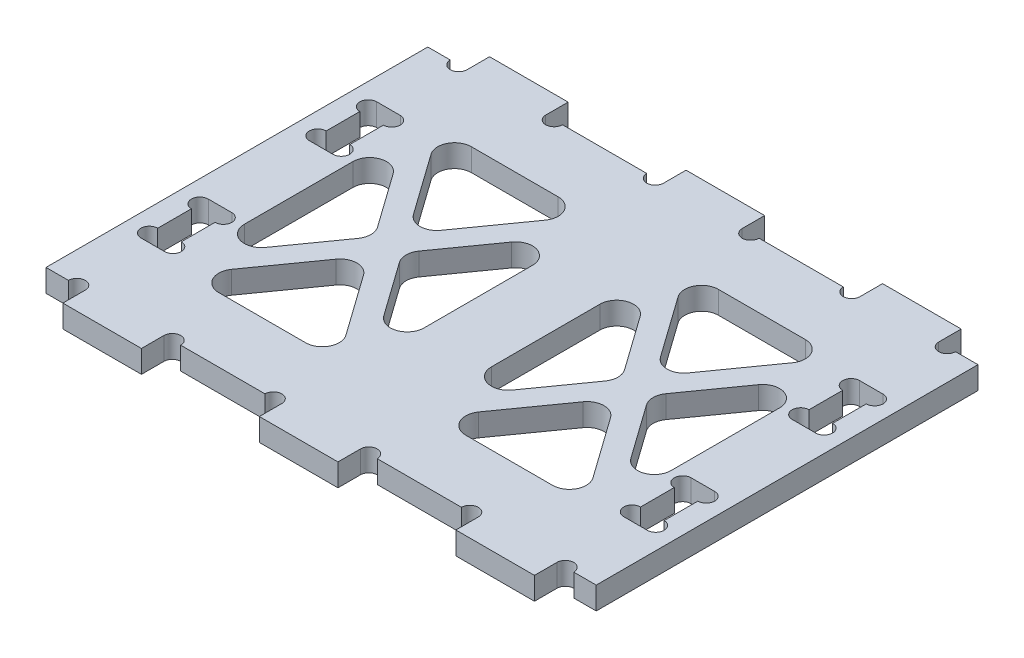
from build123d import *

# Parameters (mm, degrees)
SKETCH_1_W          = 14
SKETCH_1_H          = 4
SKETCH_1_W_2        = 98
SKETCH_1_H_2        = 68
EXTRUDE_1_DEPTH     = 4
SKETCH_2_R          = 1.5
CUT_EXTRUDE_1_DEPTH = 4
SKETCH_3_R          = 1.5
SKETCH_3_W          = 4.2
SKETCH_3_H          = 12
CUT_EXTRUDE_2_DEPTH = 10
CUT_EXTRUDE_3_DEPTH = 5
FILLET_1_R          = 3


with BuildPart() as part:
    # 草图1 → 凸台-拉伸1 (new body)
    with BuildSketch(Plane(origin=(0, 0, 0), x_dir=(1, 0, 0), z_dir=(0, 1, 0))):
        with Locations((-35, -36)):
            Rectangle(SKETCH_1_W, SKETCH_1_H)
        Rectangle(SKETCH_1_W_2, SKETCH_1_H_2)
        with Locations((0, -36)):
            Rectangle(SKETCH_1_W, SKETCH_1_H)
        with Locations((35, -36)):
            Rectangle(SKETCH_1_W, SKETCH_1_H)
        with Locations((-35, 36)):
            Rectangle(SKETCH_1_W, SKETCH_1_H)
        with Locations((35, 36)):
            Rectangle(SKETCH_1_W, SKETCH_1_H)
        with Locations((0, 36)):
            Rectangle(SKETCH_1_W, SKETCH_1_H)
    extrude(amount=EXTRUDE_1_DEPTH)

    # 草图2 → 切除-拉伸1 (cut)
    with BuildSketch(Plane(origin=(0, 4, 0), x_dir=(1, 0, 0), z_dir=(0, 1, 0))):
        with Locations((-43.5, 34)):
            Circle(SKETCH_2_R)
        with Locations((-26.5, 34)):
            Circle(SKETCH_2_R)
        with Locations((-8.5, 34)):
            Circle(SKETCH_2_R)
        with Locations((-43.5, -34)):
            Circle(SKETCH_2_R)
        with Locations((-26.5, -34)):
            Circle(SKETCH_2_R)
        with Locations((-8.5, -34)):
            Circle(SKETCH_2_R)
        with Locations((8.5, 34)):
            Circle(SKETCH_2_R)
        with Locations((26.5, 34)):
            Circle(SKETCH_2_R)
        with Locations((26.5, -34)):
            Circle(SKETCH_2_R)
        with Locations((8.5, -34)):
            Circle(SKETCH_2_R)
        with Locations((43.5, -34)):
            Circle(SKETCH_2_R)
        with Locations((43.5, 34)):
            Circle(SKETCH_2_R)
    extrude(amount=-CUT_EXTRUDE_1_DEPTH, mode=Mode.SUBTRACT)

    # 草图3 → 切除-拉伸2 (cut)
    with BuildSketch(Plane(origin=(0, 4, 0), x_dir=(1, 0, 0), z_dir=(0, 1, 0))):
        with Locations((45.1, 10.5)):
            Circle(SKETCH_3_R)
        with Locations((45.1, 19.5)):
            Circle(SKETCH_3_R)
        with Locations((40.9, 19.5)):
            Circle(SKETCH_3_R)
        with Locations((40.9, 10.5)):
            Circle(SKETCH_3_R)
        with Locations((43, 15)):
            Rectangle(SKETCH_3_W, SKETCH_3_H)
        with BuildLine():
            ThreePointArc((42.4, 10.5), (41.960660172, 11.560660172), (40.9, 12))
            Line((40.9, 12), (40.9, 9))
            ThreePointArc((40.9, 9), (41.960660172, 9.439339828), (42.4, 10.5))
        make_face()
        with BuildLine():
            Line((40.9, 9), (40.9, 12))
            ThreePointArc((40.9, 12), (39.4, 10.5), (40.9, 9))
        make_face()
        with BuildLine():
            ThreePointArc((42.4, 19.5), (41.960660172, 20.560660172), (40.9, 21))
            Line((40.9, 21), (40.9, 18))
            ThreePointArc((40.9, 18), (41.960660172, 18.439339828), (42.4, 19.5))
        make_face()
        with BuildLine():
            Line((40.9, 18), (40.9, 21))
            ThreePointArc((40.9, 21), (39.4, 19.5), (40.9, 18))
        make_face()
        with BuildLine():
            ThreePointArc((46.6, 19.5), (46.160660172, 20.560660172), (45.1, 21))
            Line((45.1, 21), (45.1, 18))
            ThreePointArc((45.1, 18), (46.160660172, 18.439339828), (46.6, 19.5))
        make_face()
        with BuildLine():
            Line((45.1, 18), (45.1, 21))
            ThreePointArc((45.1, 21), (43.6, 19.5), (45.1, 18))
        make_face()
        with BuildLine():
            ThreePointArc((46.6, 10.5), (46.160660172, 11.560660172), (45.1, 12))
            Line((45.1, 12), (45.1, 9))
            ThreePointArc((45.1, 9), (46.160660172, 9.439339828), (46.6, 10.5))
        make_face()
        with BuildLine():
            Line((45.1, 9), (45.1, 12))
            ThreePointArc((45.1, 12), (43.6, 10.5), (45.1, 9))
        make_face()
        with BuildLine():
            ThreePointArc((40.9, -18), (39.4, -19.5), (40.9, -21))
            Line((40.9, -21), (40.9, -18))
        make_face()
        with BuildLine():
            Line((40.9, -18), (40.9, -21))
            ThreePointArc((40.9, -21), (41.960660172, -20.560660172), (42.4, -19.5))
            ThreePointArc((42.4, -19.5), (41.960660172, -18.439339828), (40.9, -18))
        make_face()
        with Locations((40.9, -19.5)):
            Circle(SKETCH_3_R)
        with Locations((45.1, -19.5)):
            Circle(SKETCH_3_R)
        with Locations((45.1, -10.5)):
            Circle(SKETCH_3_R)
        with Locations((40.9, -10.5)):
            Circle(SKETCH_3_R)
        with Locations((43, -15)):
            Rectangle(SKETCH_3_W, SKETCH_3_H)
        with BuildLine():
            ThreePointArc((45.1, -18), (43.6, -19.5), (45.1, -21))
            Line((45.1, -21), (45.1, -18))
        make_face()
        with BuildLine():
            Line((45.1, -18), (45.1, -21))
            ThreePointArc((45.1, -21), (46.160660172, -20.560660172), (46.6, -19.5))
            ThreePointArc((46.6, -19.5), (46.160660172, -18.439339828), (45.1, -18))
        make_face()
        with BuildLine():
            ThreePointArc((40.9, -9), (39.4, -10.5), (40.9, -12))
            Line((40.9, -12), (40.9, -9))
        make_face()
        with BuildLine():
            Line((40.9, -9), (40.9, -12))
            ThreePointArc((40.9, -12), (41.960660172, -11.560660172), (42.4, -10.5))
            ThreePointArc((42.4, -10.5), (41.960660172, -9.439339828), (40.9, -9))
        make_face()
        with BuildLine():
            ThreePointArc((45.1, -9), (43.6, -10.5), (45.1, -12))
            Line((45.1, -12), (45.1, -9))
        make_face()
        with BuildLine():
            Line((45.1, -9), (45.1, -12))
            ThreePointArc((45.1, -12), (46.160660172, -11.560660172), (46.6, -10.5))
            ThreePointArc((46.6, -10.5), (46.160660172, -9.439339828), (45.1, -9))
        make_face()
    cut_extrude_2 = extrude(amount=-CUT_EXTRUDE_2_DEPTH, mode=Mode.SUBTRACT)

    # 镜向1: 切除-拉伸2 across plane
    add(cut_extrude_2.mirror(Plane(origin=(0, 0, 0), x_dir=(0, 0, 1), z_dir=(1, 0, 0))), mode=Mode.SUBTRACT)

    # 草图4 → 切除-拉伸3 (cut)
    with BuildSketch(Plane(origin=(0, 4, 0), x_dir=(1, 0, 0), z_dir=(0, 1, 0))):
        Polygon((-24.454122256, 0), (-38, 19.048890577), (-38, -19.048890577), align=None)
        Polygon((-8.454122256, 22.5), (-35.545877744, 22.5), (-22, 3.451109423), align=None)
        Polygon((-6, 19.048890577), (-19.545877744, 0), (-6, -19.048890577), align=None)
        Polygon((-8.454122256, -22.5), (-22, -3.451109423), (-35.545877744, -22.5), align=None)
        Polygon((19.545877744, 0), (6, 19.048890577), (6, -19.048890577), align=None)
        Polygon((8.454122256, 22.5), (22, 3.451109423), (35.545877744, 22.5), align=None)
        Polygon((38, 19.048890577), (24.454122256, 0), (38, -19.048890577), align=None)
        Polygon((35.545877744, -22.5), (22, -3.451109423), (8.454122256, -22.5), align=None)
    extrude(amount=-CUT_EXTRUDE_3_DEPTH, mode=Mode.SUBTRACT)

    # 圆角1
    fillet_1_edges = [part.edges().sort_by_distance(p)[0] for p in [
        (6, 2, -19.048890577),
        (19.545877744, 2, 0),
        (6, 2, 19.048890577),
        (-22, 2, 3.451109423),
        (-8.454122256, 2, 22.5),
        (-35.545877744, 2, 22.5),
        (-8.454122256, 2, -22.5),
        (-22, 2, -3.451109423),
        (-35.545877744, 2, -22.5),
        (-6, 2, -19.048890577),
        (-6, 2, 19.048890577),
        (-19.545877744, 2, 0),
        (35.545877744, 2, 22.5),
        (8.454122256, 2, 22.5),
        (22, 2, 3.451109423),
        (35.545877744, 2, -22.5),
        (22, 2, -3.451109423),
        (8.454122256, 2, -22.5),
        (38, 2, -19.048890577),
        (38, 2, 19.048890577),
        (24.454122256, 2, 0),
        (-24.454122256, 2, 0),
        (-38, 2, 19.048890577),
        (-38, 2, -19.048890577),
    ]]
    fillet(fillet_1_edges, radius=FILLET_1_R)


solid = part.part
